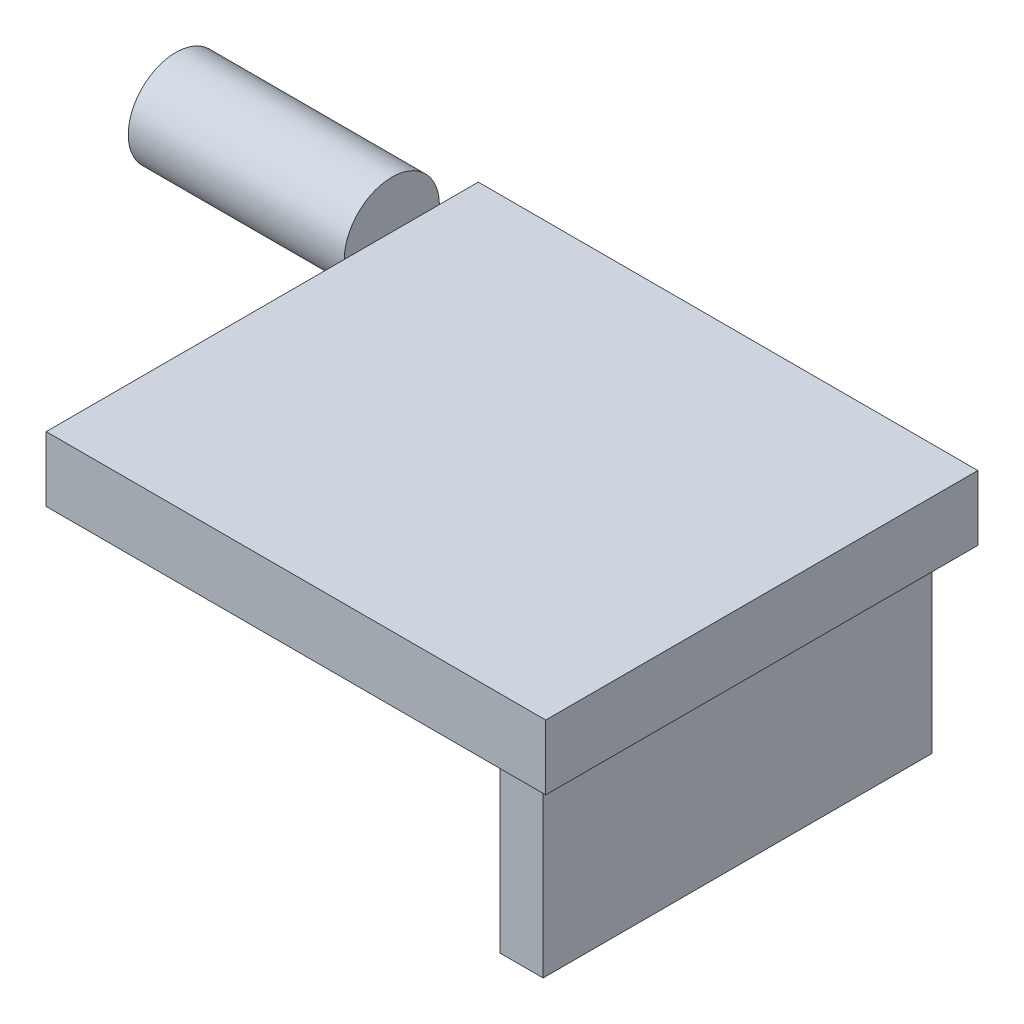
from build123d import *

# Parameters (mm, degrees)
SKETCH1_W           = 29.3624
SKETCH1_H           = 25.4
BOSS_EXTRUDE1_DEPTH = 3.81
SKETCH2_W           = 2.54
SKETCH2_H           = 22.86
BOSS_EXTRUDE2_DEPTH = 10.668
SKETCH3_R           = 2.794
BOSS_EXTRUDE3_DEPTH = 12.7


with BuildPart() as part:
    # Sketch1 → Boss-Extrude1 (new body)
    with BuildSketch(Plane(origin=(0, 0, 0), x_dir=(1, 0, 0), z_dir=(0, 1, 0))):
        with Locations((14.6812, 12.7)):
            Rectangle(SKETCH1_W, SKETCH1_H)
    extrude(amount=BOSS_EXTRUDE1_DEPTH)

    # Sketch2 → Boss-Extrude2 (add)
    with BuildSketch(Plane.XZ):
        with Locations((26.67, -12.7)):
            Rectangle(SKETCH2_W, SKETCH2_H)
    extrude(amount=BOSS_EXTRUDE2_DEPTH)

    # Sketch3 → Boss-Extrude3 (add)
    with BuildSketch(Plane.ZY):
        with Locations((-20.32, 3.81)):
            Circle(SKETCH3_R)
    extrude(amount=BOSS_EXTRUDE3_DEPTH)


solid = part.part
